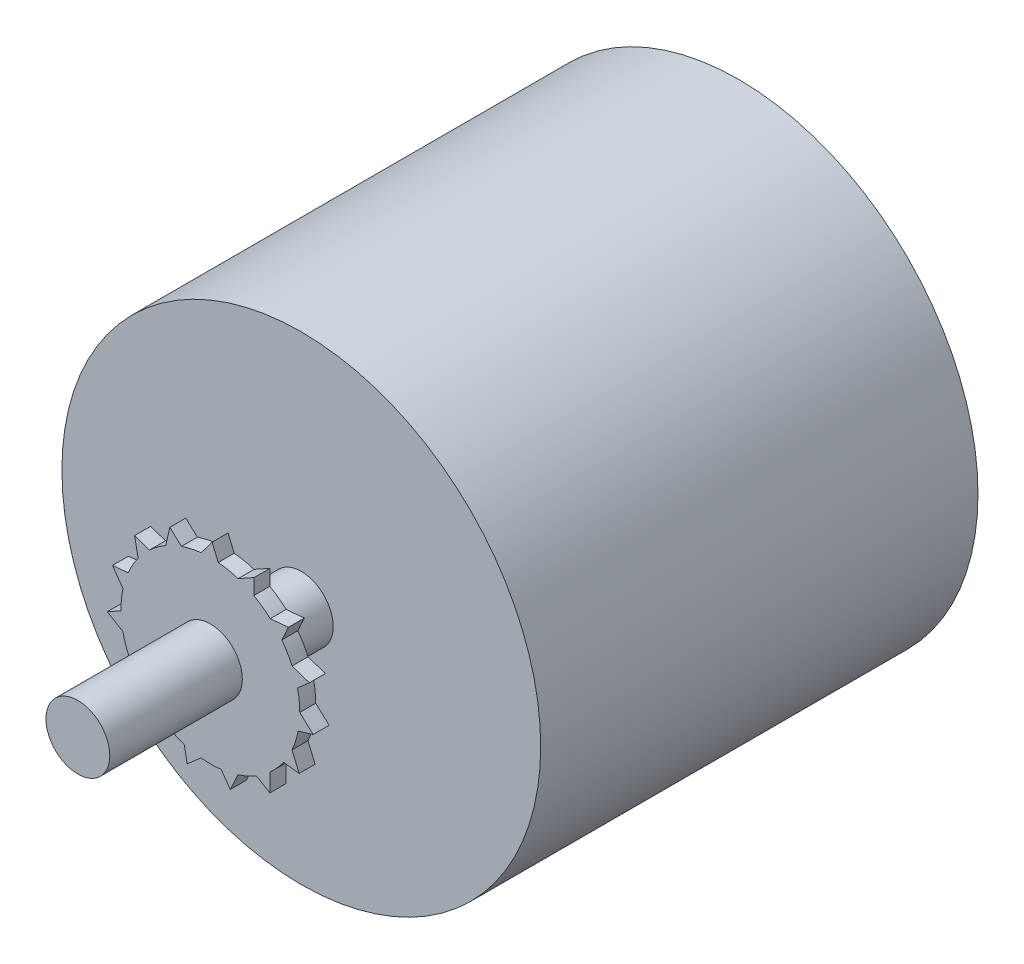
from build123d import *

# Parameters (mm, degrees)
SKETCH1_R           = 75
BOSS_EXTRUDE1_DEPTH = 137
SKETCH2_R           = 10
BOSS_EXTRUDE2_DEPTH = 70
SKETCH4_R           = 28
BOSS_EXTRUDE3_DEPTH = 5
BOSS_EXTRUDE4_DEPTH = 5
CIRPATTERN1_COUNT   = 15


with BuildPart() as part:
    # Sketch1 → Boss-Extrude1 (new body)
    with BuildSketch(Plane.XY):
        Circle(SKETCH1_R)
    extrude(amount=BOSS_EXTRUDE1_DEPTH)

    # Sketch2 → Boss-Extrude2 (add)
    with BuildSketch(Plane.XY.offset(137)):
        Circle(SKETCH2_R)
    extrude(amount=BOSS_EXTRUDE2_DEPTH)

    # Sketch4 → Boss-Extrude3 (add)
    with BuildSketch(Plane.XY.offset(160.48)):
        Circle(SKETCH4_R)
    extrude(amount=BOSS_EXTRUDE3_DEPTH)

    # Sketch5 → Boss-Extrude4 (add)
    with BuildSketch(Plane.XY.offset(165.48)):
        Polygon((3.567039891, 25.329459933), (0.529235594, 32.424417196), (-4.096275486, 26.246122872), align=None)
    boss_extrude4 = extrude(amount=-BOSS_EXTRUDE4_DEPTH)

    # CirPattern1: Boss-Extrude4 ×15 about axis
    cirpattern1_axis = Axis((0, 0, 0), (0, 0, 1))
    for i in range(1, CIRPATTERN1_COUNT):
        add(boss_extrude4.rotate(cirpattern1_axis, i * 360 / CIRPATTERN1_COUNT))


solid = part.part
